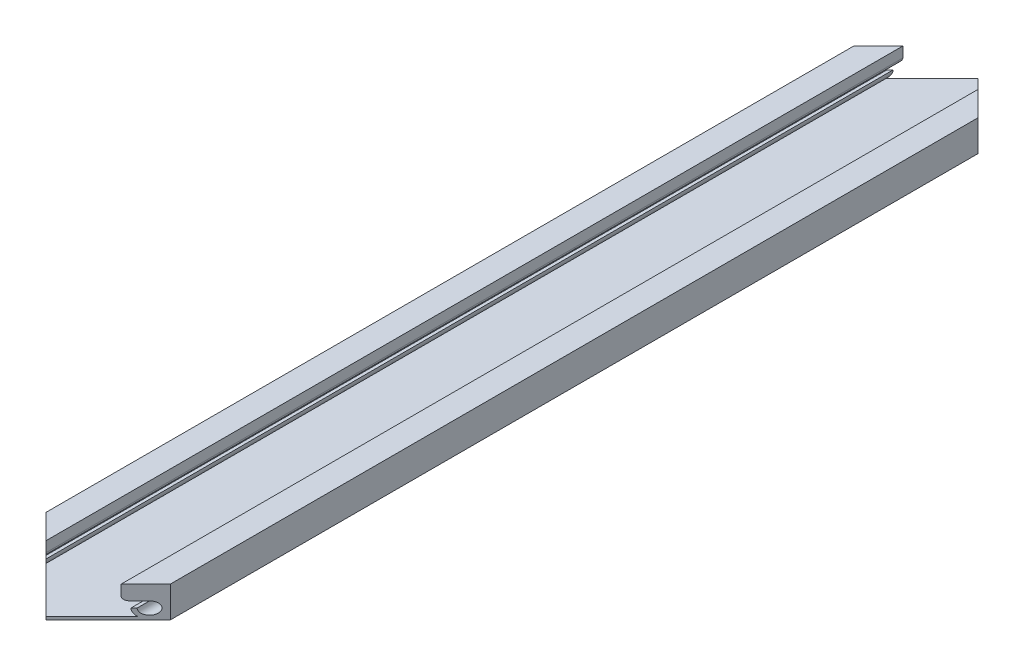
from build123d import *

# Parameters (mm, degrees)
SKETCH_1_W          = 60
SKETCH_1_H          = 15
EXTRUDE_1_DEPTH     = 450
SKETCH_2_R          = 3
CUT_EXTRUDE_1_DEPTH = 452.061248613
CUT_EXTRUDE_2_DEPTH = 452.061248613
SKETCH_4_W          = 36.3
SKETCH_4_H          = 7
CUT_EXTRUDE_3_DEPTH = 452.061248613
FILLET_1_R          = 2
CUT_EXTRUDE_4_DEPTH = 452.248268695


with BuildPart() as part:
    # 스케치1 → 보스-돌출1 (new body)
    with BuildSketch(Plane.XY):
        Rectangle(SKETCH_1_W, SKETCH_1_H)
    extrude(amount=EXTRUDE_1_DEPTH)

    # 스케치2 → 컷-돌출1 (cut, through all)
    with BuildSketch(Plane(origin=(0, 0, 0), x_dir=(-1, 0, 0), z_dir=(0, 0, -1))):
        with Locations((-25, -2.5)):
            Circle(SKETCH_2_R)
        with Locations((25, -2.5)):
            Circle(SKETCH_2_R)
    extrude(amount=-CUT_EXTRUDE_1_DEPTH, mode=Mode.SUBTRACT)

    # 스케치3 → 컷-돌출2 (cut, through all)
    with BuildSketch(Plane(origin=(0, 0, 0), x_dir=(-1, 0, 0), z_dir=(0, 0, -1))):
        with BuildLine():
            Line((-22.171572875, -6), (22.171572875, -6))
            ThreePointArc((22.171572875, -6), (20.939339828, -4.439339828), (20.5, -2.5))
            Line((20.5, -2.5), (25, -2.5))
            Line((25, -2.5), (25, 0.5))
            Line((25, 0.5), (-25, 0.5))
            Line((-25, 0.5), (-25, -2.5))
            Line((-25, -2.5), (-20.5, -2.5))
            ThreePointArc((-20.5, -2.5), (-20.939339828, -4.439339828), (-22.171572875, -6))
        make_face()
    extrude(amount=-CUT_EXTRUDE_2_DEPTH, mode=Mode.SUBTRACT)

    # 스케치4 → 컷-돌출3 (cut, through all)
    with BuildSketch(Plane(origin=(0, 0, 0), x_dir=(-1, 0, 0), z_dir=(0, 0, -1))):
        with Locations((0.006888359, 4)):
            Rectangle(SKETCH_4_W, SKETCH_4_H)
    extrude(amount=-CUT_EXTRUDE_3_DEPTH, mode=Mode.SUBTRACT)

    # 필렛1
    fillet_1_edges = [part.edges().sort_by_distance(p)[0] for p in [
        (-18.156888359, 0.5, 225),
        (18.143111641, 0.5, 225),
    ]]
    fillet(fillet_1_edges, radius=FILLET_1_R)

    # 스케치5 → 컷-돌출4 (cut, through all)
    with BuildSketch(Plane.XZ.offset(7.5)):
        Polygon((30, 450), (0, 450), (30, 420), align=None)
        Polygon((0, 450), (-30, 450), (-30, 420), align=None)
        Polygon((0, 0), (-30, 30), (-30, 0), align=None)
        Polygon((30, 30), (0, 0), (30, 0), align=None)
    extrude(amount=-CUT_EXTRUDE_4_DEPTH, mode=Mode.SUBTRACT)


solid = part.part
